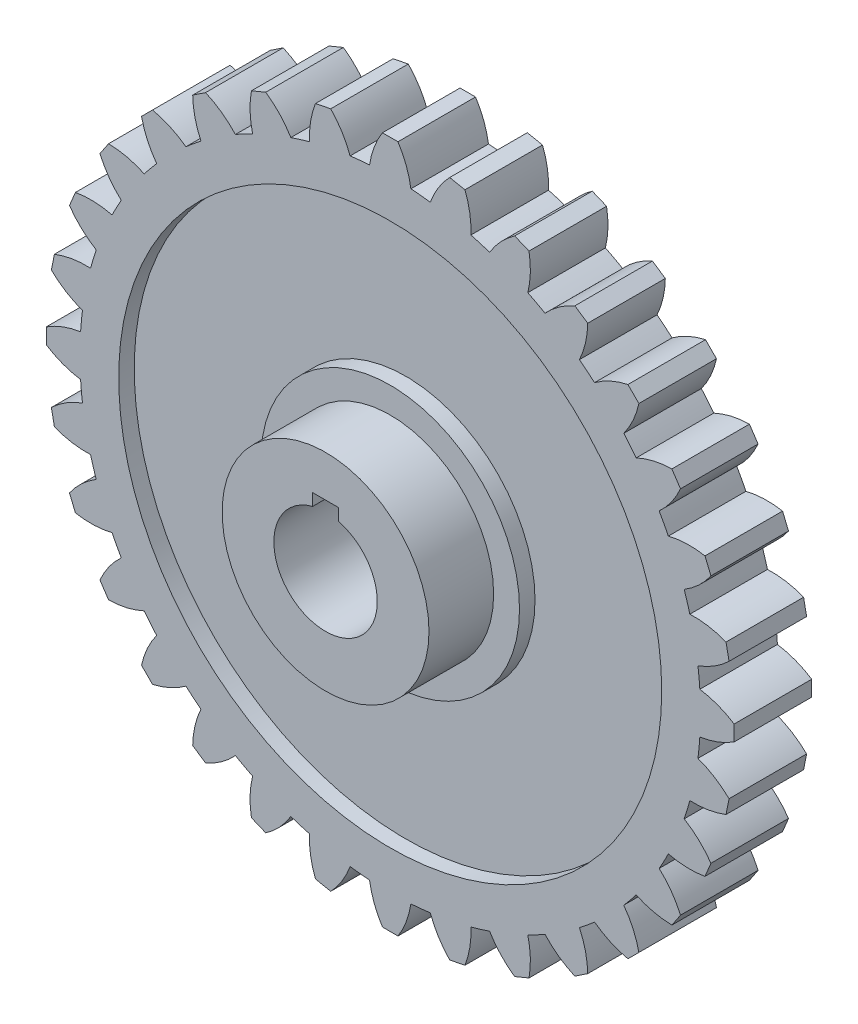
from build123d import *

# Parameters (mm, degrees)
SKETCH2_R           = 60
BOSS_EXTRUDE1_DEPTH = 7.5
BOSS_EXTRUDE3_START = -15
BOSS_EXTRUDE3_DEPTH = 15
CIRPATTERN1_COUNT   = 32
SKETCH4_R           = 20
BOSS_EXTRUDE4_DEPTH = 20
CUT_EXTRUDE1_DEPTH  = 103.198336581
CUT_EXTRUDE2_START  = 7.5
SKETCH6_R           = 52.5
SKETCH6_R_2         = 25
CUT_EXTRUDE2_DEPTH  = 3


with BuildPart() as part:
    # Sketch2 → Boss-Extrude1 (new, symmetric)
    with BuildSketch(Plane.XY):
        Circle(SKETCH2_R)
    extrude(amount=BOSS_EXTRUDE1_DEPTH, both=True)

    # Sketch3 → Boss-Extrude3 (add)
    with BuildSketch(Plane.XY.offset(7.5).offset(BOSS_EXTRUDE3_START)):
        with BuildLine():
            Line((-1.5, 66.5), (1.5, 66.5))
            ThreePointArc((1.5, 66.5), (3.099609074, 63.315018359), (4, 59.866518188))
            ThreePointArc((4, 59.866518188), (0, 60), (-4, 59.866518188))
            ThreePointArc((-4, 59.866518188), (-3.099609074, 63.315018359), (-1.5, 66.5))
        make_face()
    boss_extrude3 = extrude(amount=BOSS_EXTRUDE3_DEPTH)

    # CirPattern1: Boss-Extrude3 ×32 about axis
    cirpattern1_axis = Axis((0, 0, 0), (0, 0, 1))
    for i in range(1, CIRPATTERN1_COUNT):
        add(boss_extrude3.rotate(cirpattern1_axis, i * 360 / CIRPATTERN1_COUNT))

    # Sketch4 → Boss-Extrude4 (add, symmetric)
    with BuildSketch(Plane.XY):
        Circle(SKETCH4_R)
    extrude(amount=BOSS_EXTRUDE4_DEPTH, both=True)

    # Sketch5 → Cut-Extrude1 (cut, through all)
    with BuildSketch(Plane.XY.offset(20)):
        with BuildLine():
            Line((-2.5, 12), (2.5, 12))
            Line((2.5, 12), (2.5, 9.682458366))
            ThreePointArc((2.5, 9.682458366), (0, -10), (-2.5, 9.682458366))
            Line((-2.5, 9.682458366), (-2.5, 12))
        make_face()
    extrude(amount=-CUT_EXTRUDE1_DEPTH, mode=Mode.SUBTRACT)

    # Sketch6 → Cut-Extrude2 (cut)
    with BuildSketch(Plane.XY.offset(CUT_EXTRUDE2_START)):
        Circle(SKETCH6_R)
        Circle(SKETCH6_R_2, mode=Mode.SUBTRACT)
    cut_extrude2 = extrude(amount=-CUT_EXTRUDE2_DEPTH, mode=Mode.SUBTRACT)

    # Mirror1: Cut-Extrude2 across plane
    add(cut_extrude2.mirror(Plane.XY), mode=Mode.SUBTRACT)


solid = part.part
